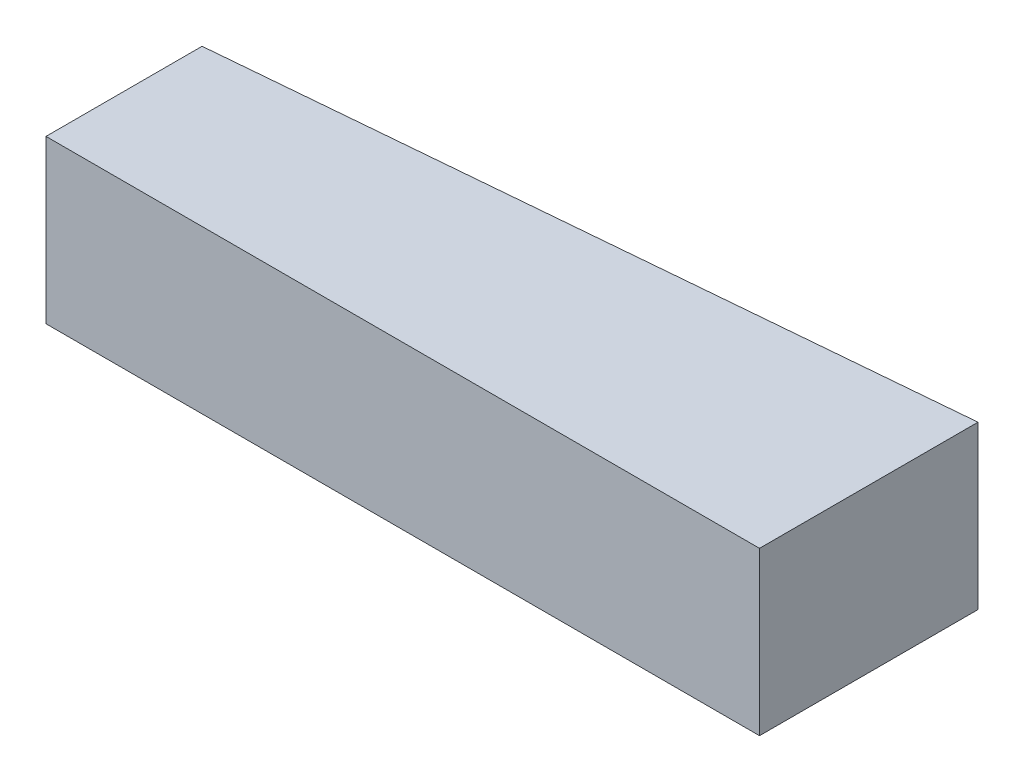
from build123d import *

# Parameters (mm, degrees)
BOSS_EXTRUDE1_DEPTH = 2.6


with BuildPart() as part:
    # Sketch2 → Boss-Extrude1 (new body)
    with BuildSketch(Plane(origin=(0, 0, 0), x_dir=(1, 0, 0), z_dir=(0, 1, 0))):
        Polygon((0, 0), (0, 2.5), (11.430052303, 3.5), (11.430052303, 0), align=None)
    extrude(amount=BOSS_EXTRUDE1_DEPTH)


solid = part.part
